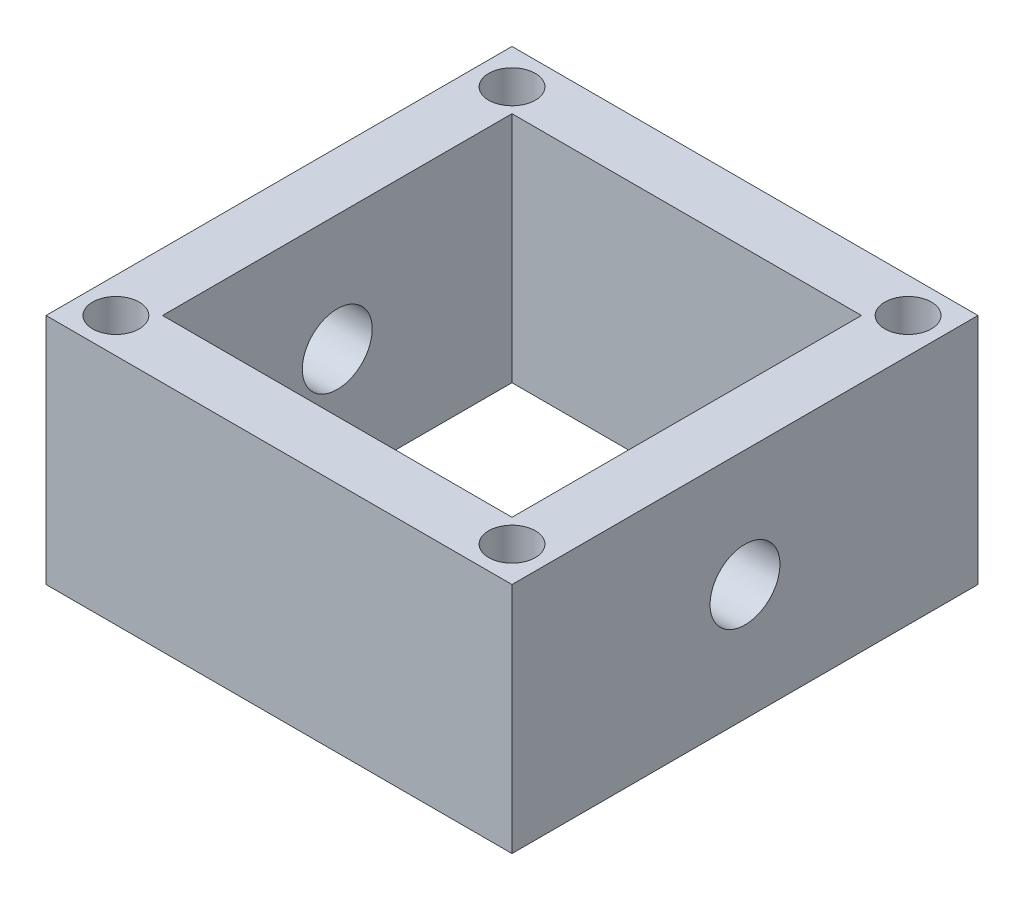
from build123d import *

# Parameters (mm, degrees)
SKETCH1_W           = 20
SKETCH1_H           = 20
SKETCH1_W_2         = 15
SKETCH1_H_2         = 15
BOSS_EXTRUDE1_DEPTH = 10
SKETCH2_R           = 1.5
CUT_EXTRUDE1_DEPTH  = 25.494897428
SKETCH3_R           = 1
CUT_EXTRUDE2_DEPTH  = 6


with BuildPart() as part:
    # Sketch1 → Boss-Extrude1 (new body)
    with BuildSketch(Plane(origin=(0, 0, 0), x_dir=(1, 0, 0), z_dir=(0, 1, 0))):
        Rectangle(SKETCH1_W, SKETCH1_H)
        Rectangle(SKETCH1_W_2, SKETCH1_H_2, mode=Mode.SUBTRACT)
    extrude(amount=BOSS_EXTRUDE1_DEPTH)

    # Sketch2 → Cut-Extrude1 (cut, through all)
    with BuildSketch(Plane.ZY.offset(10)):
        with Locations((0, 5)):
            Circle(SKETCH2_R)
    extrude(amount=-CUT_EXTRUDE1_DEPTH, mode=Mode.SUBTRACT)

    # Sketch3 → Cut-Extrude2 (cut)
    with BuildSketch(Plane(origin=(0, 10, 0), x_dir=(1, 0, 0), z_dir=(0, 1, 0))):
        with Locations(Location((-8.5, 8.5, 0), (0, 0, 270))):
            Circle(SKETCH3_R)
        with Locations(Location((8.5, 8.5, 0), (0, 0, 270))):
            Circle(SKETCH3_R)
        with Locations(Location((8.5, -8.5, 0), (0, 0, 270))):
            Circle(SKETCH3_R)
        with Locations(Location((-8.5, -8.5, 0), (0, 0, 270))):
            Circle(SKETCH3_R)
    extrude(amount=-CUT_EXTRUDE2_DEPTH, mode=Mode.SUBTRACT)


solid = part.part
